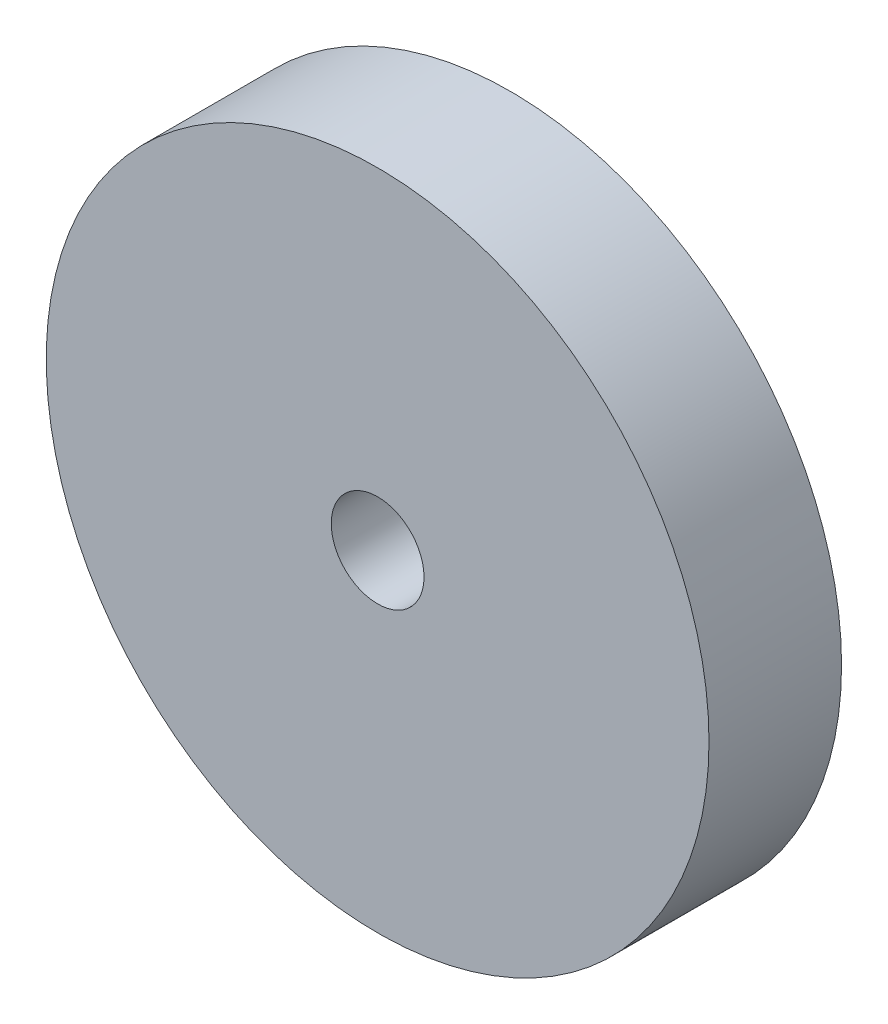
from build123d import *

# Parameters (mm, degrees)
SKETCH1_R           = 2.5
SKETCH1_R_2         = 0.35
BOSS_EXTRUDE1_DEPTH = 1


with BuildPart() as part:
    # Sketch1 → Boss-Extrude1 (new body)
    with BuildSketch(Plane.XY):
        Circle(SKETCH1_R)
        Circle(SKETCH1_R_2, mode=Mode.SUBTRACT)
    extrude(amount=BOSS_EXTRUDE1_DEPTH)


solid = part.part
